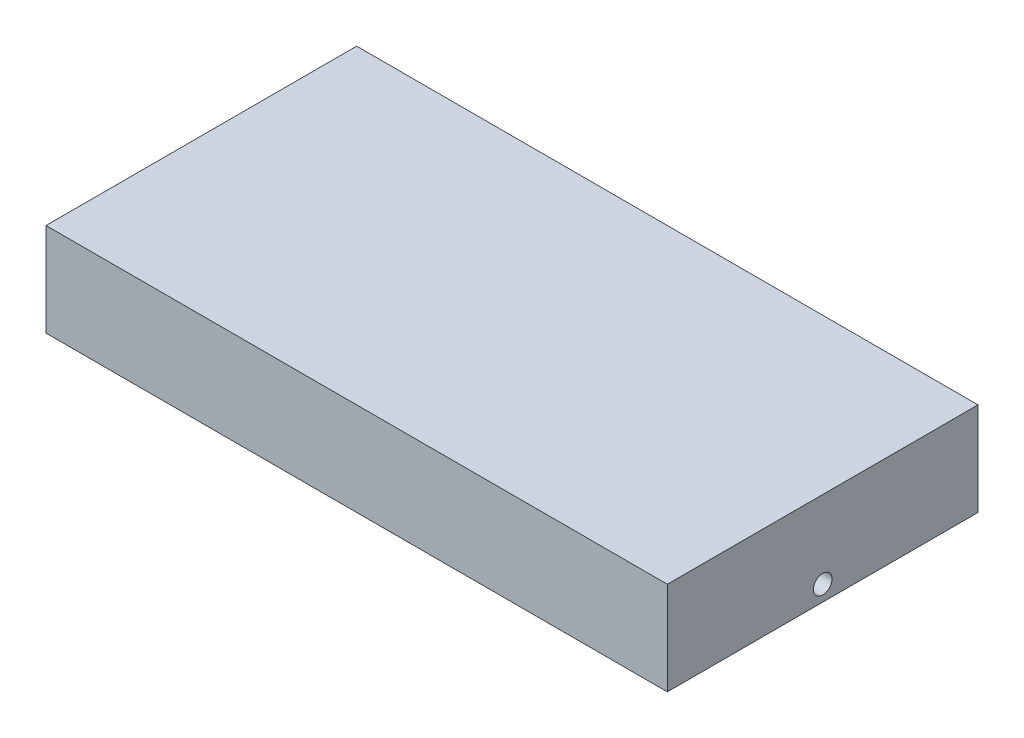
from build123d import *

# Parameters (mm, degrees)
SKETCH_1_W           = 20
SKETCH_1_H           = 10
EXTRUDE_1_DEPTH      = 3
SKETCH_2_W           = 16
SKETCH_2_H           = 6
CUT_EXTRUDE_1_DEPTH  = 2
SKETCH_3_W           = 6
SKETCH_3_H           = 0.2
CUT_EXTRUDE_2_DEPTH  = 1.5
SKETCH_5_W           = 1.3
SKETCH_5_H           = 6
CUT_EXTRUDE_4_DEPTH  = 1.3
SKETCH_11_R          = 0.3
CUT_EXTRUDE_7_DEPTH  = 0.5
SKETCH_14_W          = 1.4
SKETCH_14_H          = 6
CUT_EXTRUDE_9_DEPTH  = 1.5
CUT_EXTRUDE_START    = -0.5
SKETCH_15_R          = 0.3
CUT_EXTRUDE_10_DEPTH = 0.5


with BuildPart() as part:
    # 草图1 → 凸台-拉伸1 (new body)
    with BuildSketch(Plane(origin=(0, 0, 0), x_dir=(1, 0, 0), z_dir=(0, 1, 0))):
        Rectangle(SKETCH_1_W, SKETCH_1_H)
    extrude(amount=EXTRUDE_1_DEPTH)

    # 草图2 → 切除-拉伸1 (cut)
    with BuildSketch(Plane(origin=(0, 0, 0), x_dir=(1, 0, 0), z_dir=(0, 1, 0))):
        Rectangle(SKETCH_2_W, SKETCH_2_H)
    extrude(amount=CUT_EXTRUDE_1_DEPTH, mode=Mode.SUBTRACT)

    # 草图3 → 切除-拉伸2 (cut)
    with BuildSketch(Plane(origin=(-8, 0, 0), x_dir=(0, 0, -1), z_dir=(1, 0, 0))):
        with Locations((0, 1.4)):
            Rectangle(SKETCH_3_W, SKETCH_3_H)
    extrude(amount=-CUT_EXTRUDE_2_DEPTH, mode=Mode.SUBTRACT)

    # 草图5 → 切除-拉伸4 (cut)
    with BuildSketch(Plane.XZ.offset(-1.5)):
        with Locations((-8.85, 0)):
            Rectangle(SKETCH_5_W, SKETCH_5_H)
    extrude(amount=CUT_EXTRUDE_4_DEPTH, mode=Mode.SUBTRACT)

    # 草图11 → 切除-拉伸7 (cut)
    with BuildSketch(Plane.ZY.offset(10)):
        with Locations((0, 0.5)):
            Circle(SKETCH_11_R)
    extrude(amount=-CUT_EXTRUDE_7_DEPTH, mode=Mode.SUBTRACT)

    # 草图14 → 切除-拉伸9 (cut)
    with BuildSketch(Plane.XZ):
        with Locations((8.8, 0)):
            Rectangle(SKETCH_14_W, SKETCH_14_H)
    extrude(amount=-CUT_EXTRUDE_9_DEPTH, mode=Mode.SUBTRACT)

    # 草图15 → 切除-拉伸10 (cut)
    with BuildSketch(Plane(origin=(10, 0, 0), x_dir=(0, 0, -1), z_dir=(1, 0, 0)).offset(CUT_EXTRUDE_START)):
        with Locations(Location((0, 0.5, 0), (0, 0, 180))):
            Circle(SKETCH_15_R)
    extrude(amount=CUT_EXTRUDE_10_DEPTH, mode=Mode.SUBTRACT)


solid = part.part
